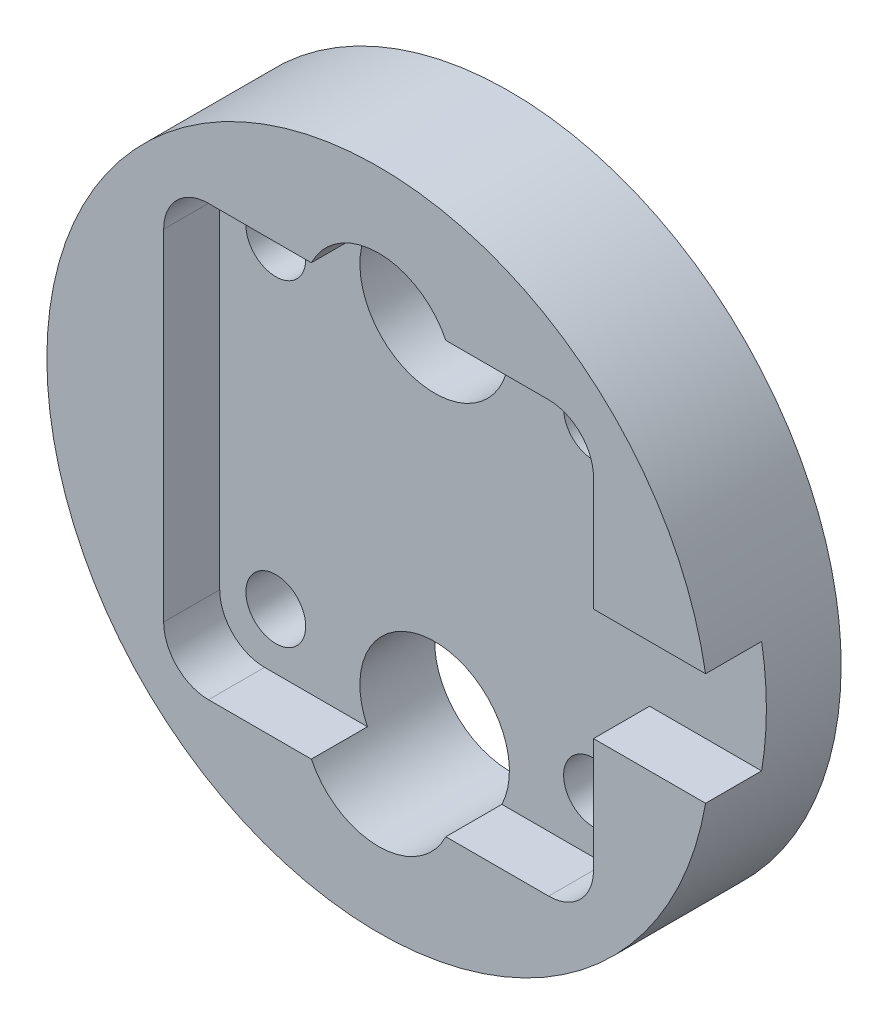
from build123d import *

# Parameters (mm, degrees)
SKETCH1_R           = 17.75
SKETCH1_R_2         = 4
BOSS_EXTRUDE1_DEPTH = 7
CUT_EXTRUDE1_START  = 7
SKETCH1_3_W         = 23
SKETCH1_3_H         = 23
SKETCH1_3_R         = 1.6
CUT_EXTRUDE1_DEPTH  = 3
SKETCH1_4_R         = 1.6
CUT_EXTRUDE3_DEPTH  = 27.060026861
CUT_EXTRUDE4_START  = -3
CUT_EXTRUDE4_DEPTH  = 3
FILLET1_R           = 2.4


with BuildPart() as part:
    # Sketch1 → Boss-Extrude1 (new body)
    with BuildSketch(Plane(origin=(0, 0, 0), x_dir=(0, 1, 0), z_dir=(0, 0, 1))):
        with Locations(Location((0, 0, 0), (0, 0, 270))):
            Circle(SKETCH1_R)
        with Locations(Location((9.75, 0, 0), (0, 0, 270))):
            Circle(SKETCH1_R_2, mode=Mode.SUBTRACT)
        with Locations(Location((-9.75, 0, 0), (0, 0, 270))):
            Circle(SKETCH1_R_2, mode=Mode.SUBTRACT)
    extrude(amount=BOSS_EXTRUDE1_DEPTH)

    # Sketch1<3> → Cut-Extrude1 (cut)
    # profile 1 of 5: a face of its own
    with BuildSketch(Plane(origin=(0, 0, 0), x_dir=(0, 1, 0), z_dir=(0, 0, 1)).offset(CUT_EXTRUDE1_START)):
        Rectangle(SKETCH1_3_W, SKETCH1_3_H)
        with Locations((-8.5, -8.5)):
            Circle(SKETCH1_3_R, mode=Mode.SUBTRACT)
        with Locations((8.5, -8.5)):
            Circle(SKETCH1_3_R, mode=Mode.SUBTRACT)
        with Locations((8.5, 8.5)):
            Circle(SKETCH1_3_R, mode=Mode.SUBTRACT)
        with Locations((-8.5, 8.5)):
            Circle(SKETCH1_3_R, mode=Mode.SUBTRACT)
    # profile 2 of 5: a face of its own
    with BuildSketch(Plane(origin=(0, 0, 0), x_dir=(0, 1, 0), z_dir=(0, 0, 1)).offset(CUT_EXTRUDE1_START)):
        with Locations((-8.5, 8.5)):
            Circle(SKETCH1_3_R)
    # profile 3 of 5: a face of its own
    with BuildSketch(Plane(origin=(0, 0, 0), x_dir=(0, 1, 0), z_dir=(0, 0, 1)).offset(CUT_EXTRUDE1_START)):
        with Locations((8.5, 8.5)):
            Circle(SKETCH1_3_R)
    # profile 4 of 5: a face of its own
    with BuildSketch(Plane(origin=(0, 0, 0), x_dir=(0, 1, 0), z_dir=(0, 0, 1)).offset(CUT_EXTRUDE1_START)):
        with Locations((-8.5, -8.5)):
            Circle(SKETCH1_3_R)
    # profile 5 of 5: a face of its own
    with BuildSketch(Plane(origin=(0, 0, 0), x_dir=(0, 1, 0), z_dir=(0, 0, 1)).offset(CUT_EXTRUDE1_START)):
        with Locations((8.5, -8.5)):
            Circle(SKETCH1_3_R)
    extrude(amount=-CUT_EXTRUDE1_DEPTH, mode=Mode.SUBTRACT)

    # Sketch1<4> → Cut-Extrude3 (cut, through all)
    with BuildSketch(Plane(origin=(0, 0, 0), x_dir=(0, 1, 0), z_dir=(0, 0, 1))):
        with Locations(Location((-8.5, -8.5, 0), (0, 0, 270))):
            Circle(SKETCH1_4_R)
        with Locations(Location((8.5, -8.5, 0), (0, 0, 270))):
            Circle(SKETCH1_4_R)
        with Locations(Location((8.5, 8.5, 0), (0, 0, 270))):
            Circle(SKETCH1_4_R)
        with Locations(Location((-8.5, 8.5, 0), (0, 0, 270))):
            Circle(SKETCH1_4_R)
    extrude(amount=CUT_EXTRUDE3_DEPTH, mode=Mode.SUBTRACT)

    # Sketch2 → Cut-Extrude4 (cut)
    with BuildSketch(Plane.XY.offset(7).offset(CUT_EXTRUDE4_START)):
        with BuildLine():
            Line((11.5, 3), (17.494642037, 3))
            ThreePointArc((17.494642037, 3), (17.75, 0), (17.494642037, -3))
            Line((17.494642037, -3), (11.5, -3))
            Line((11.5, -3), (11.5, 3))
        make_face()
    extrude(amount=CUT_EXTRUDE4_DEPTH, mode=Mode.SUBTRACT)

    # Fillet1
    fillet1_edges = [part.edges().sort_by_distance(p)[0] for p in [
        (-11.5, -11.5, 5.5),
        (-11.5, 11.5, 5.5),
        (11.5, 11.5, 5.5),
        (11.5, -11.5, 5.5),
    ]]
    fillet(fillet1_edges, radius=FILLET1_R)


solid = part.part
